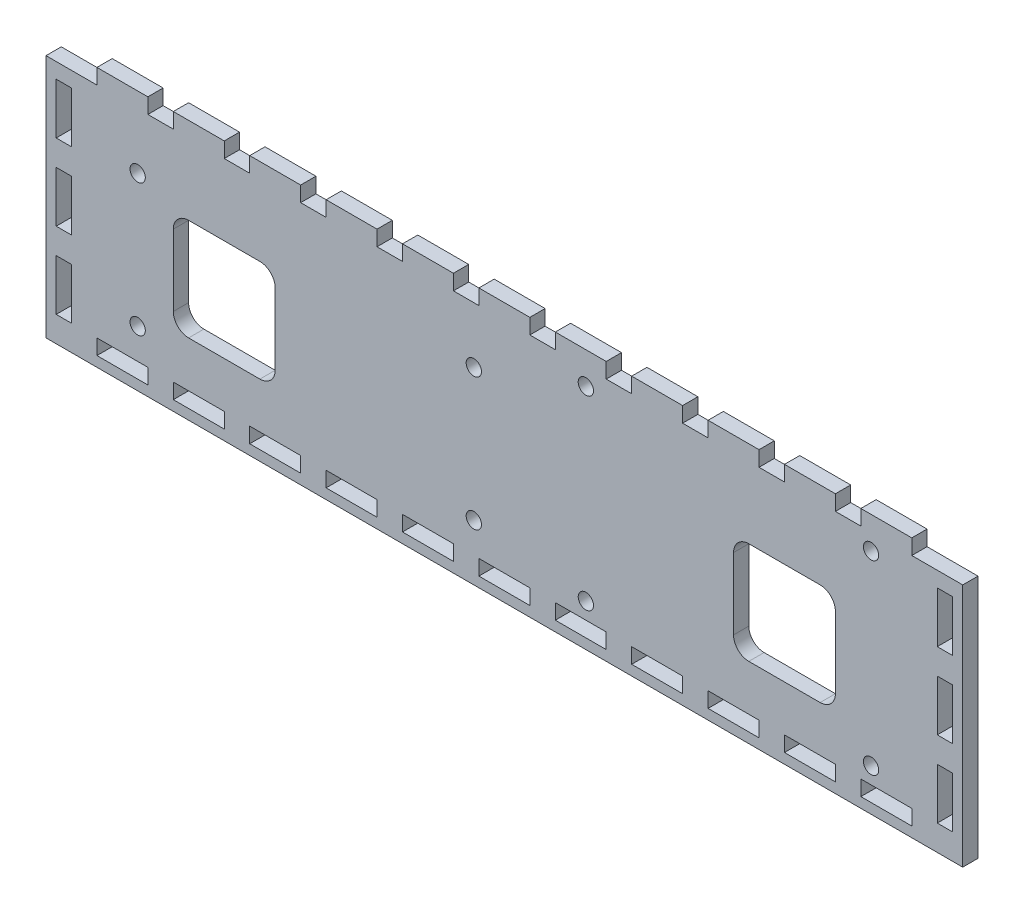
from build123d import *

# Parameters (mm, degrees)
SKETCH_1_W          = 3
SKETCH_1_H          = 10
SKETCH_1_W_2        = 10
SKETCH_1_H_2        = 3
EXTRUDE_1_DEPTH     = 3
SKETCH_2_W          = 20
SKETCH_2_H          = 20
CUT_EXTRUDE_1_DEPTH = 10
FILLET_1_R          = 3
SKETCH_3_R          = 1.5
CUT_EXTRUDE_2_DEPTH = 10


with BuildPart() as part:
    # 草图1 → 凸台-拉伸1 (new body)
    with BuildSketch(Plane.XY):
        Polygon((-90, 24), (-80, 24), (-80, 27), (-70, 27), (-70, 24), (-65, 24), (-65, 27), (-55, 27), (-55, 24), (-50, 24), (-50, 27), (-40, 27), (-40, 24), (-35, 24), (-35, 27), (-25, 27), (-25, 24), (-20, 24), (-20, 27), (-10, 27), (-10, 24), (-5, 24), (-5, 27), (5, 27), (5, 24), (10, 24), (10, 27), (20, 27), (20, 24), (25, 24), (25, 27), (35, 27), (35, 24), (40, 24), (40, 27), (50, 27), (50, 24), (55, 24), (55, 27), (65, 27), (65, 24), (70, 24), (70, 27), (80, 27), (80, 24), (90, 24), (90, -24), (-90, -24), align=None)
        with Locations((-86.5, 1)):
            Rectangle(SKETCH_1_W, SKETCH_1_H, mode=Mode.SUBTRACT)
        with Locations((-86.5, 16)):
            Rectangle(SKETCH_1_W, SKETCH_1_H, mode=Mode.SUBTRACT)
        with Locations((-86.5, -14)):
            Rectangle(SKETCH_1_W, SKETCH_1_H, mode=Mode.SUBTRACT)
        with Locations((86.5, -14)):
            Rectangle(SKETCH_1_W, SKETCH_1_H, mode=Mode.SUBTRACT)
        with Locations((86.5, 1)):
            Rectangle(SKETCH_1_W, SKETCH_1_H, mode=Mode.SUBTRACT)
        with Locations((86.5, 16)):
            Rectangle(SKETCH_1_W, SKETCH_1_H, mode=Mode.SUBTRACT)
        with Locations((-60, -20.5)):
            Rectangle(SKETCH_1_W_2, SKETCH_1_H_2, mode=Mode.SUBTRACT)
        with Locations((-75, -20.5)):
            Rectangle(SKETCH_1_W_2, SKETCH_1_H_2, mode=Mode.SUBTRACT)
        with Locations((-45, -20.5)):
            Rectangle(SKETCH_1_W_2, SKETCH_1_H_2, mode=Mode.SUBTRACT)
        with Locations((-30, -20.5)):
            Rectangle(SKETCH_1_W_2, SKETCH_1_H_2, mode=Mode.SUBTRACT)
        with Locations((-15, -20.5)):
            Rectangle(SKETCH_1_W_2, SKETCH_1_H_2, mode=Mode.SUBTRACT)
        with Locations((0, -20.5)):
            Rectangle(SKETCH_1_W_2, SKETCH_1_H_2, mode=Mode.SUBTRACT)
        with Locations((15, -20.5)):
            Rectangle(SKETCH_1_W_2, SKETCH_1_H_2, mode=Mode.SUBTRACT)
        with Locations((30, -20.5)):
            Rectangle(SKETCH_1_W_2, SKETCH_1_H_2, mode=Mode.SUBTRACT)
        with Locations((45, -20.5)):
            Rectangle(SKETCH_1_W_2, SKETCH_1_H_2, mode=Mode.SUBTRACT)
        with Locations((60, -20.5)):
            Rectangle(SKETCH_1_W_2, SKETCH_1_H_2, mode=Mode.SUBTRACT)
        with Locations((75, -20.5)):
            Rectangle(SKETCH_1_W_2, SKETCH_1_H_2, mode=Mode.SUBTRACT)
    extrude(amount=EXTRUDE_1_DEPTH)

    # 草图2 → 切除-拉伸1 (cut)
    with BuildSketch(Plane.XY.offset(3)):
        with Locations((55, 0)):
            Rectangle(SKETCH_2_W, SKETCH_2_H)
        with Locations((-55, 0)):
            Rectangle(SKETCH_2_W, SKETCH_2_H)
    extrude(amount=-CUT_EXTRUDE_1_DEPTH, mode=Mode.SUBTRACT)

    # 圆角1
    fillet_1_edges = [part.edges().sort_by_distance(p)[0] for p in [
        (65, 10, 1.5),
        (65, -10, 1.5),
        (45, -10, 1.5),
        (45, 10, 1.5),
        (-45, 10, 1.5),
        (-45, -10, 1.5),
        (-65, -10, 1.5),
        (-65, 10, 1.5),
    ]]
    fillet(fillet_1_edges, radius=FILLET_1_R)

    # 草图3 → 切除-拉伸2 (cut)
    with BuildSketch(Plane.XY.offset(3)):
        with Locations((-72, 13)):
            Circle(SKETCH_3_R)
        with Locations((-6, 13)):
            Circle(SKETCH_3_R)
        with Locations((-72, -13)):
            Circle(SKETCH_3_R)
        with Locations((-6, -13)):
            Circle(SKETCH_3_R)
        with Locations((16, 20.75)):
            Circle(SKETCH_3_R)
        with Locations((16, -15.75)):
            Circle(SKETCH_3_R)
        with Locations((72, 20.75)):
            Circle(SKETCH_3_R)
        with Locations((72, -15.75)):
            Circle(SKETCH_3_R)
    extrude(amount=-CUT_EXTRUDE_2_DEPTH, mode=Mode.SUBTRACT)


solid = part.part
